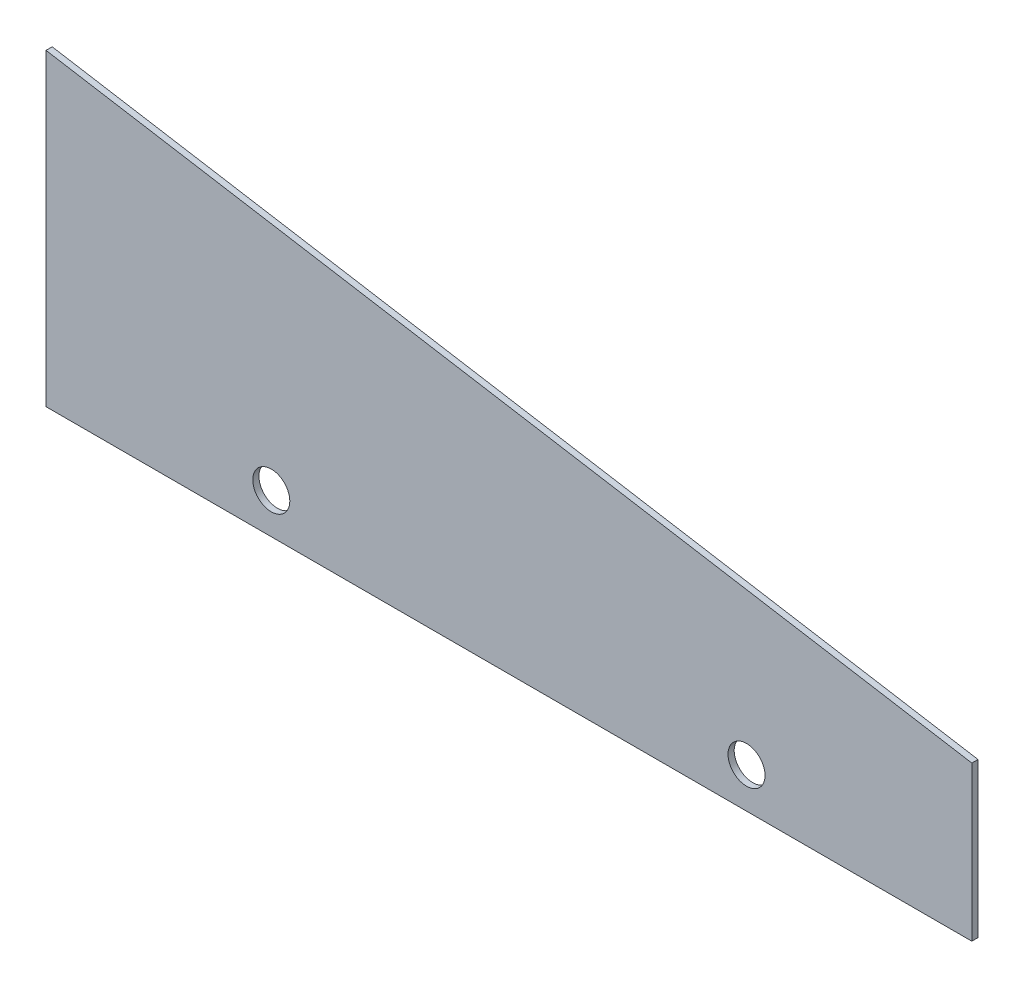
from build123d import *

# Parameters (mm, degrees)
SALIENTE_EXTRUIR1_DEPTH = 2
CROQUIS2_R              = 6
CORTAR_EXTRUIR1_DEPTH   = 181.288657436


with BuildPart() as part:
    # Croquis1 → Saliente-Extruir1 (new body)
    with BuildSketch(Plane.XY):
        Polygon((150, 0), (-150, 0), (-150, 100), (150, 50), align=None)
    extrude(amount=SALIENTE_EXTRUIR1_DEPTH)

    # Croquis2 → Cortar-Extruir1 (cut, through all)
    with BuildSketch(Plane.XY.offset(2)):
        with Locations((-77, 13)):
            Circle(CROQUIS2_R)
        with Locations((77, 13)):
            Circle(CROQUIS2_R)
    extrude(amount=-CORTAR_EXTRUIR1_DEPTH, mode=Mode.SUBTRACT)


solid = part.part
